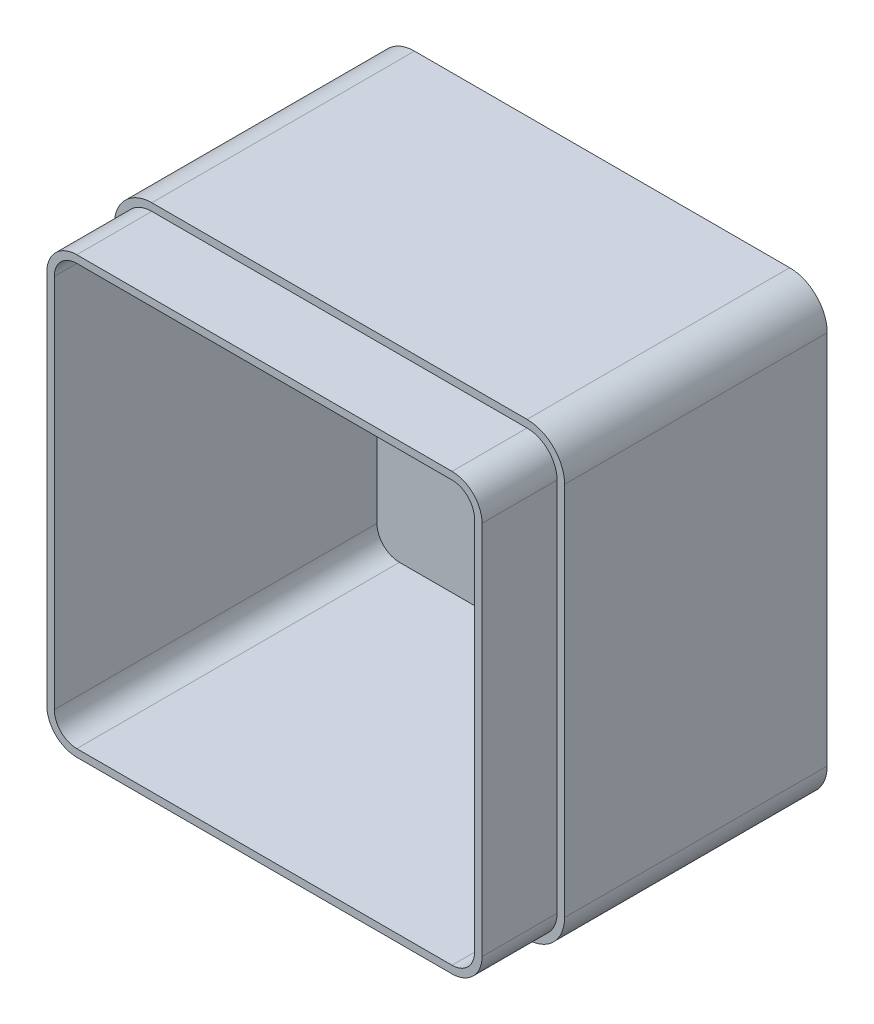
from build123d import *

# Parameters (mm, degrees)
SKETCH1_W           = 120
SKETCH1_H           = 120
BOSS_EXTRUDE1_DEPTH = 90
FILLET1_R           = 10
SHELL1_T            = -4
CUT_EXTRUDE10_DEPTH = 20


with BuildPart() as part:
    # Sketch1 → Boss-Extrude1 (new body)
    with BuildSketch(Plane.XY):
        with Locations((60, 60)):
            Rectangle(SKETCH1_W, SKETCH1_H)
    extrude(amount=BOSS_EXTRUDE1_DEPTH)

    # Fillet1
    fillet1_edges = [part.edges().sort_by_distance(p)[0] for p in [
        (0, 120, 45),
        (120, 120, 45),
        (120, 0, 45),
        (0, 0, 45),
    ]]
    fillet(fillet1_edges, radius=FILLET1_R)

    # Shell1
    shell1_openings = [part.faces().sort_by_distance(p)[0] for p in [
        (60, 60, 90),
    ]]
    offset(amount=SHELL1_T, openings=shell1_openings, kind=Kind.INTERSECTION)

    # Sketch9 → Cut-Extrude10 (cut)
    with BuildSketch(Plane.XY.offset(90)):
        with BuildLine():
            Line((10, 0), (110, 0))
            ThreePointArc((110, 0), (117.071067812, 2.928932188), (120, 10))
            Line((120, 10), (120, 110))
            ThreePointArc((120, 110), (117.071067812, 117.071067812), (110, 120))
            Line((110, 120), (10, 120))
            ThreePointArc((10, 120), (2.928932188, 117.071067812), (0, 110))
            Line((0, 110), (0, 10))
            ThreePointArc((0, 10), (2.928932188, 2.928932188), (10, 0))
        make_face()
        with BuildLine():
            Line((10, 2), (110, 2))
            ThreePointArc((110, 2), (115.656854249, 4.343145751), (118, 10))
            Line((118, 10), (118, 110))
            ThreePointArc((118, 110), (115.656854249, 115.656854249), (110, 118))
            Line((110, 118), (10, 118))
            ThreePointArc((10, 118), (4.343145751, 115.656854249), (2, 110))
            Line((2, 110), (2, 10))
            ThreePointArc((2, 10), (4.343145751, 4.343145751), (10, 2))
        make_face(mode=Mode.SUBTRACT)
    extrude(amount=-CUT_EXTRUDE10_DEPTH, mode=Mode.SUBTRACT)


solid = part.part
